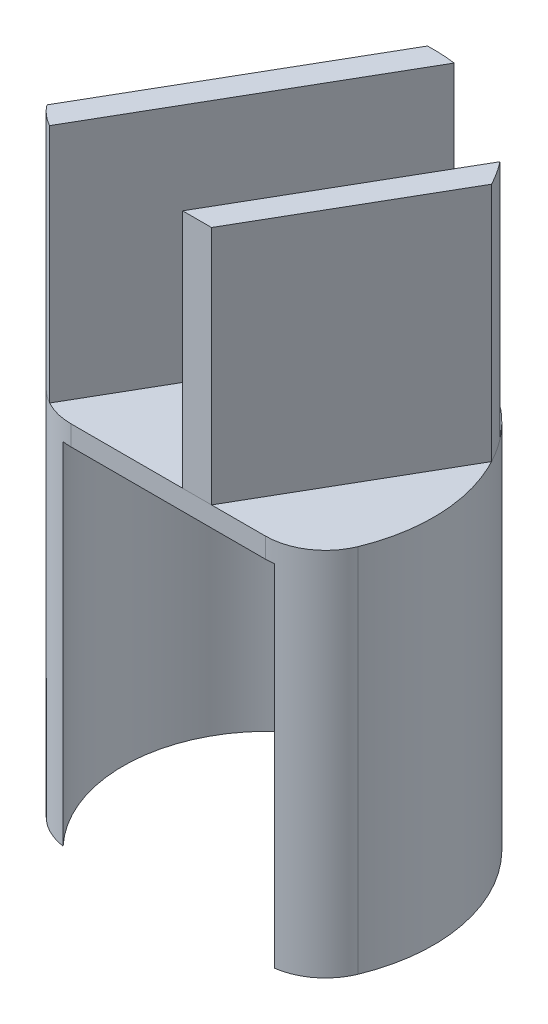
from build123d import *

# Parameters (mm, degrees)
SKETCH_1_R          = 16.5
SKETCH_1_R_2        = 14.5
EXTRUDE_1_DEPTH     = 35
SKETCH_3_R          = 16.5
EXTRUDE_2_DEPTH     = 2
SKETCH_4_W          = 49.747728002
SKETCH_4_H          = 43.690708299
CUT_EXTRUDE_1_DEPTH = 49.40970977
CUT_EXTRUDE_2_REACH = 45.744
SKETCH_5_R          = 3.75
FILLET_1_R          = 6
EXTRUDE_3_DEPTH     = 24
EXTRUDE_3_2_DEPTH   = 24


with BuildPart() as part:
    # 草图1 → 凸台-拉伸1 (new body)
    with BuildSketch(Plane(origin=(0, 0, 0), x_dir=(1, 0, 0), z_dir=(0, 1, 0))):
        with Locations(Location((0, 0, 0), (0, 0, 270))):
            Circle(SKETCH_1_R)
        with Locations(Location((0, 0, 0), (0, 0, 270))):
            Circle(SKETCH_1_R_2, mode=Mode.SUBTRACT)
    extrude(amount=EXTRUDE_1_DEPTH)

    # 草图3 → 凸台-拉伸2 (add)
    with BuildSketch(Plane(origin=(0, 35, 0), x_dir=(1, 0, 0), z_dir=(0, 1, 0))):
        with Locations(Location((0, 0, 0), (0, 0, 270))):
            Circle(SKETCH_3_R)
    extrude(amount=EXTRUDE_2_DEPTH)

    # 草图4 → 切除-拉伸1 (cut, through all)
    with BuildSketch(Plane.XY.offset(10)):
        with Locations((3.540684312, 17.876483266)):
            Rectangle(SKETCH_4_W, SKETCH_4_H)
    extrude(amount=CUT_EXTRUDE_1_DEPTH, mode=Mode.SUBTRACT)

    # 草图5 → 切除-拉伸2 (cut, up to next)
    with BuildSketch(Plane(origin=(0, 37, 0), x_dir=(1, 0, 0), z_dir=(0, 1, 0)), mode=Mode.PRIVATE) as cut_extrude_2_sk1:
        with Locations(Location((0, 0, 0), (0, 0, 270))):
            Circle(SKETCH_5_R)
    cut_extrude_2_tool1 = extrude(cut_extrude_2_sk1.sketch, amount=-CUT_EXTRUDE_2_REACH, mode=Mode.PRIVATE) & part.part
    add(cut_extrude_2_tool1.solids().sort_by_distance((0, 37, 0))[0], mode=Mode.SUBTRACT)

    # 圆角1
    fillet_1_edges = [part.edges().sort_by_distance(p)[0] for p in [
        (13.124404748, 18.5, 10),
        (-13.124404748, 18.5, 10),
    ]]
    fillet(fillet_1_edges, radius=FILLET_1_R)


with BuildPart() as body_2:
    # 草图6 → 凸台-拉伸3 (new body)
    with BuildSketch(Plane(origin=(0, 37, 0), x_dir=(1, 0, 0), z_dir=(0, 1, 0))):
        with BuildLine():
            Line((13.047897801, 10.099621923), (1.443375673, -10))
            Line((1.443375673, -10), (4.330127019, -10))
            Line((4.330127019, -10), (14.5721397, 7.739686335))
            ThreePointArc((14.5721397, 7.739686335), (13.860337004, 8.952153826), (13.047897801, 10.099621923))
        make_face()
    extrude(amount=EXTRUDE_3_DEPTH)


with BuildPart() as body_3:
    # 草图6 → Extrude 3 2 (new body)
    with BuildSketch(Plane(origin=(0, 37, 0), x_dir=(1, 0, 0), z_dir=(0, 1, 0))):
        with BuildLine():
            Line((-0.583304866, 16.489686335), (-14.498767089, -7.612601246))
            ThreePointArc((-14.498767089, -7.612601246), (-13.623792058, -8.546260307), (-12.570735662, -9.273152854))
            Line((-12.570735662, -9.273152854), (2.222580253, 16.349621923))
            ThreePointArc((2.222580253, 16.349621923), (0.82262413, 16.479480864), (-0.583304866, 16.489686335))
        make_face()
    extrude(amount=EXTRUDE_3_2_DEPTH)


solid = Compound([part.part, body_2.part, body_3.part])
